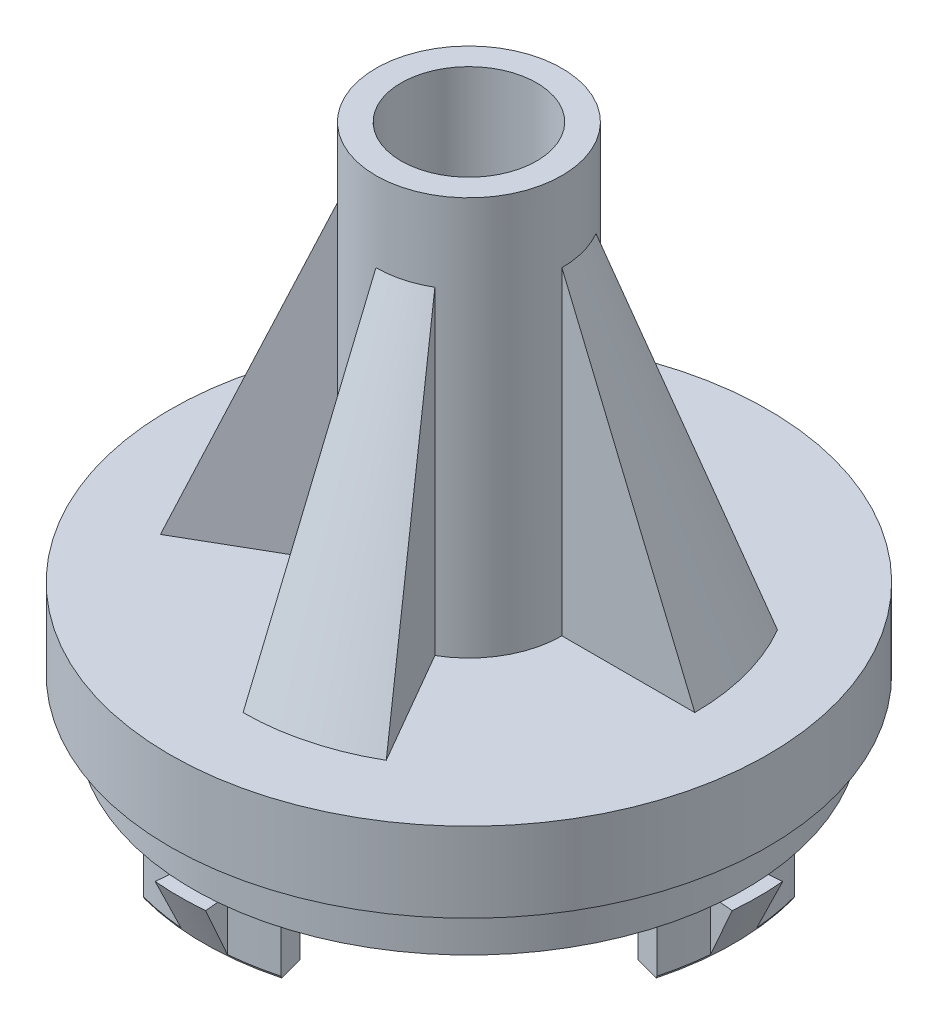
from build123d import *

# Parameters (mm, degrees)
SKETCH_1_R          = 10.4
EXTRUDE_1_DEPTH     = 1.8
SKETCH_2_R          = 11.25
EXTRUDE_2_DEPTH     = 3
SKETCH_3_R          = 3.5
SKETCH_3_R_2        = 2.55
EXTRUDE_3_DEPTH     = 15
SKETCH_3_4_R        = 1.5
CUT_EXTRUDE_2_DEPTH = 4.8
REVOLVE_3_ANGLE     = 30
REVOLVE_4_ANGLE     = 30
EXTRUDE_4_DEPTH     = 2


with BuildPart() as part:
    # 草图1 → 凸台-拉伸1 (new body)
    with BuildSketch(Plane(origin=(0, 0, 0), x_dir=(1, 0, 0), z_dir=(0, 1, 0))):
        with Locations(Location((0, 0, 0), (0, 0, 270))):
            Circle(SKETCH_1_R)
    extrude(amount=EXTRUDE_1_DEPTH)

    # 草图2 → 凸台-拉伸2 (add)
    with BuildSketch(Plane(origin=(0, 1.8, 0), x_dir=(1, 0, 0), z_dir=(0, 1, 0))):
        with Locations(Location((0, 0, 0), (0, 0, 270))):
            Circle(SKETCH_2_R)
    extrude(amount=EXTRUDE_2_DEPTH)

    # 草图3 → 凸台-拉伸3 (add)
    with BuildSketch(Plane(origin=(0, 4.8, 0), x_dir=(1, 0, 0), z_dir=(0, 1, 0))):
        with Locations(Location((0, 0, 0), (0, 0, 270))):
            Circle(SKETCH_3_R)
        with Locations(Location((0, 0, 0), (0, 0, 270))):
            Circle(SKETCH_3_R_2, mode=Mode.SUBTRACT)
    extrude(amount=EXTRUDE_3_DEPTH)

    # 草图3<4> → 切除-拉伸2 (cut)
    with BuildSketch(Plane(origin=(0, 4.8, 0), x_dir=(1, 0, 0), z_dir=(0, 1, 0))):
        with Locations(Location((0, 0, 0), (0, 0, 270))):
            Circle(SKETCH_3_4_R)
    extrude(amount=-CUT_EXTRUDE_2_DEPTH, mode=Mode.SUBTRACT)

    # 草图6 → 旋转3 (revolve)
    with BuildSketch(Plane(origin=(0, 0, 0), x_dir=(0, 0, -1), z_dir=(1, 0, 0))):
        Polygon((3.5, 4.8), (3.5, 16.8), (8.5, 4.8), align=None)
        Polygon((-8.5, 4.8), (-3.5, 4.8), (-3.5, 16.8), align=None)
    revolve(axis=Axis((0, 0, 0), (0, 1, 0)), revolution_arc=REVOLVE_3_ANGLE)

    # 草图9 → 旋转4 (revolve)
    with BuildSketch(Plane.XY):
        Polygon((3.5, 4.8), (8.5, 4.8), (3.5, 16.8), align=None)
        Polygon((-8.5, 4.8), (-3.5, 16.8), (-3.5, 4.8), align=None)
    revolve(axis=Axis((0, 0, 0), (0, 1, 0)), revolution_arc=REVOLVE_4_ANGLE)

    # 草图10 → 凸台-拉伸4 (add)
    with BuildSketch(Plane.XZ):
        with BuildLine():
            Line((9.961946981, -0.871557427), (10.858522209, -0.949997596))
            ThreePointArc((10.858522209, -0.949997596), (10.9, 0), (10.858522209, 0.949997596))
            Line((10.858522209, 0.949997596), (9.961946981, 0.871557427))
            ThreePointArc((9.961946981, 0.871557427), (9.84807753, 1.736481777), (9.659258263, 2.588190451))
            Line((9.659258263, 2.588190451), (8.693332437, 2.329371406))
            ThreePointArc((8.693332437, 2.329371406), (9, 0), (8.693332437, -2.329371406))
            Line((8.693332437, -2.329371406), (9.659258263, -2.588190451))
            ThreePointArc((9.659258263, -2.588190451), (9.84807753, -1.736481777), (9.961946981, -0.871557427))
        make_face()
        with BuildLine():
            Line((2.329371406, 8.693332437), (2.588190451, 9.659258263))
            ThreePointArc((2.588190451, 9.659258263), (1.736481777, 9.84807753), (0.871557427, 9.961946981))
            Line((0.871557427, 9.961946981), (0.949997596, 10.858522209))
            ThreePointArc((0.949997596, 10.858522209), (0, 10.9), (-0.949997596, 10.858522209))
            Line((-0.949997596, 10.858522209), (-0.871557427, 9.961946981))
            ThreePointArc((-0.871557427, 9.961946981), (-1.736481777, 9.84807753), (-2.588190451, 9.659258263))
            Line((-2.588190451, 9.659258263), (-2.329371406, 8.693332437))
            ThreePointArc((-2.329371406, 8.693332437), (0, 9), (2.329371406, 8.693332437))
        make_face()
        with BuildLine():
            Line((-2.329371406, -8.693332437), (-2.588190451, -9.659258263))
            ThreePointArc((-2.588190451, -9.659258263), (-1.736481777, -9.84807753), (-0.871557427, -9.961946981))
            Line((-0.871557427, -9.961946981), (-0.949997596, -10.858522209))
            ThreePointArc((-0.949997596, -10.858522209), (0, -10.9), (0.949997596, -10.858522209))
            Line((0.949997596, -10.858522209), (0.871557427, -9.961946981))
            ThreePointArc((0.871557427, -9.961946981), (1.736481777, -9.84807753), (2.588190451, -9.659258263))
            Line((2.588190451, -9.659258263), (2.329371406, -8.693332437))
            ThreePointArc((2.329371406, -8.693332437), (0, -9), (-2.329371406, -8.693332437))
        make_face()
        with BuildLine():
            Line((-8.693332437, 2.329371406), (-9.659258263, 2.588190451))
            ThreePointArc((-9.659258263, 2.588190451), (-9.84807753, 1.736481777), (-9.961946981, 0.871557427))
            Line((-9.961946981, 0.871557427), (-10.858522209, 0.949997596))
            ThreePointArc((-10.858522209, 0.949997596), (-10.9, 0), (-10.858522209, -0.949997596))
            Line((-10.858522209, -0.949997596), (-9.961946981, -0.871557427))
            ThreePointArc((-9.961946981, -0.871557427), (-9.84807753, -1.736481777), (-9.659258263, -2.588190451))
            Line((-9.659258263, -2.588190451), (-8.693332437, -2.329371406))
            ThreePointArc((-8.693332437, -2.329371406), (-9, 0), (-8.693332437, 2.329371406))
        make_face()
    extrude(amount=EXTRUDE_4_DEPTH)

    # 草图11 → 切除-旋转2 (revolve, cut)
    with BuildSketch(Plane.XY, mode=Mode.PRIVATE) as cut_revolve_2_sk:
        Polygon((9.961946981, -2), (10.9, -2), (10.9, 0), align=None)
    revolve(cut_revolve_2_sk.sketch.rotate(Axis((0, 0, 0), (0, -1, 0)), 275), axis=Axis((0, 0, 0), (0, -1, 0)), mode=Mode.SUBTRACT)


solid = part.part
